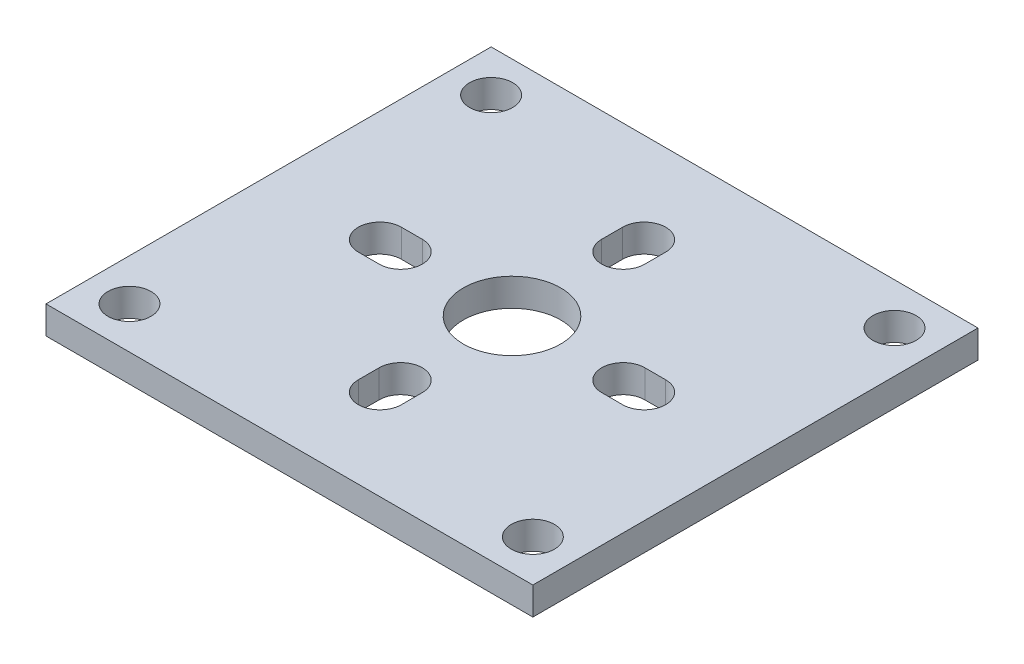
from build123d import *

# Parameters (mm, degrees)
SKETCH_1_W          = 35
SKETCH_1_H          = 32
SKETCH_1_R          = 3.5
EXTRUDE_1_DEPTH     = 2
SKETCH_2_R          = 1.55
CUT_EXTRUDE_1_DEPTH = 10


with BuildPart() as part:
    # 草图1 → 凸台-拉伸1 (new body)
    with BuildSketch(Plane(origin=(0, 0, 0), x_dir=(1, 0, 0), z_dir=(0, 1, 0))):
        Rectangle(SKETCH_1_W, SKETCH_1_H)
        with Locations(Location((0, 0, 0), (0, 0, 270))):
            Circle(SKETCH_1_R, mode=Mode.SUBTRACT)
        with BuildLine():
            Line((-1.55, 9.5), (-1.55, 8))
            ThreePointArc((-1.55, 8), (0, 6.45), (1.55, 8))
            Line((1.55, 8), (1.55, 9.5))
            ThreePointArc((1.55, 9.5), (0, 11.05), (-1.55, 9.5))
        make_face(mode=Mode.SUBTRACT)
        with BuildLine():
            Line((1.55, -9.5), (1.55, -8))
            ThreePointArc((1.55, -8), (0, -6.45), (-1.55, -8))
            Line((-1.55, -8), (-1.55, -9.5))
            ThreePointArc((-1.55, -9.5), (0, -11.05), (1.55, -9.5))
        make_face(mode=Mode.SUBTRACT)
        with BuildLine():
            Line((-9.5, -1.55), (-8, -1.55))
            ThreePointArc((-8, -1.55), (-6.45, 0), (-8, 1.55))
            Line((-8, 1.55), (-9.5, 1.55))
            ThreePointArc((-9.5, 1.55), (-11.05, 0), (-9.5, -1.55))
        make_face(mode=Mode.SUBTRACT)
        with BuildLine():
            Line((9.5, 1.55), (8, 1.55))
            ThreePointArc((8, 1.55), (6.45, 0), (8, -1.55))
            Line((8, -1.55), (9.5, -1.55))
            ThreePointArc((9.5, -1.55), (11.05, 0), (9.5, 1.55))
        make_face(mode=Mode.SUBTRACT)
    extrude(amount=EXTRUDE_1_DEPTH)

    # 草图2 → 切除-拉伸1 (cut)
    with BuildSketch(Plane(origin=(0, 2, 0), x_dir=(1, 0, 0), z_dir=(0, 1, 0))):
        with Locations(Location((-14.5, 13, 0), (0, 0, 270))):
            Circle(SKETCH_2_R)
        with Locations(Location((-14.5, -13, 0), (0, 0, 270))):
            Circle(SKETCH_2_R)
        with Locations(Location((14.5, -13, 0), (0, 0, 270))):
            Circle(SKETCH_2_R)
        with Locations(Location((14.5, 13, 0), (0, 0, 270))):
            Circle(SKETCH_2_R)
    extrude(amount=-CUT_EXTRUDE_1_DEPTH, mode=Mode.SUBTRACT)


solid = part.part
